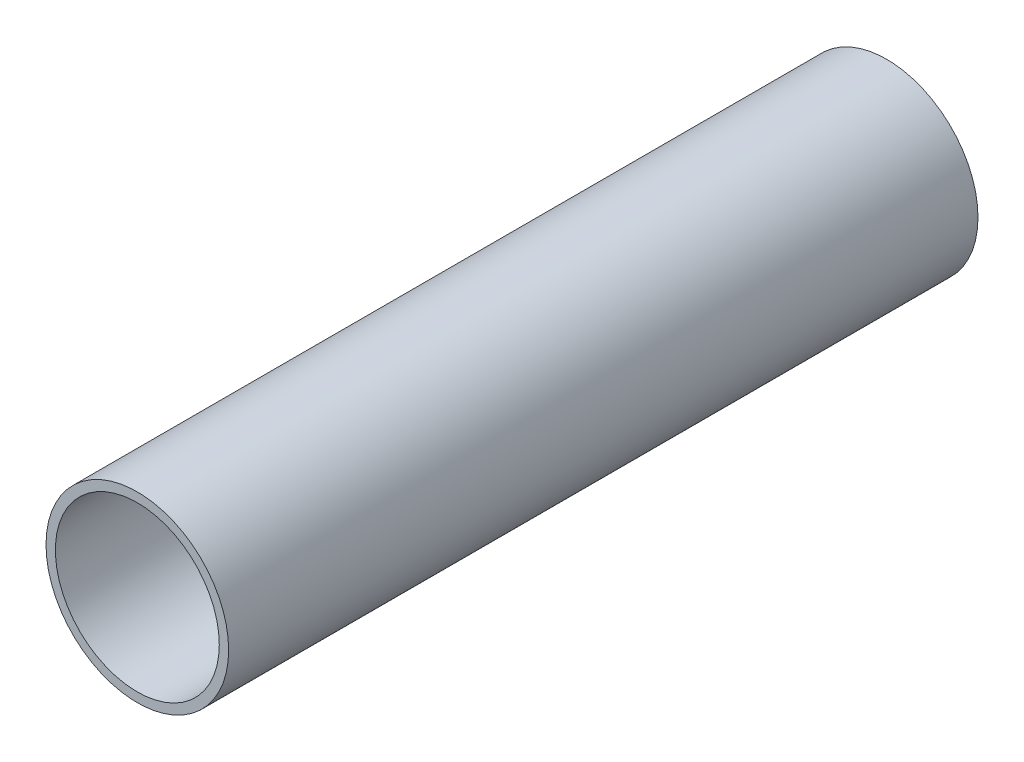
from build123d import *

# Parameters (mm, degrees)
SKETCH1_R           = 1.95
SKETCH1_R_2         = 1.75
BOSS_EXTRUDE1_DEPTH = 16


with BuildPart() as part:
    # Sketch1 → Boss-Extrude1 (new body)
    with BuildSketch(Plane.XY):
        Circle(SKETCH1_R)
        Circle(SKETCH1_R_2, mode=Mode.SUBTRACT)
    extrude(amount=BOSS_EXTRUDE1_DEPTH)


solid = part.part
